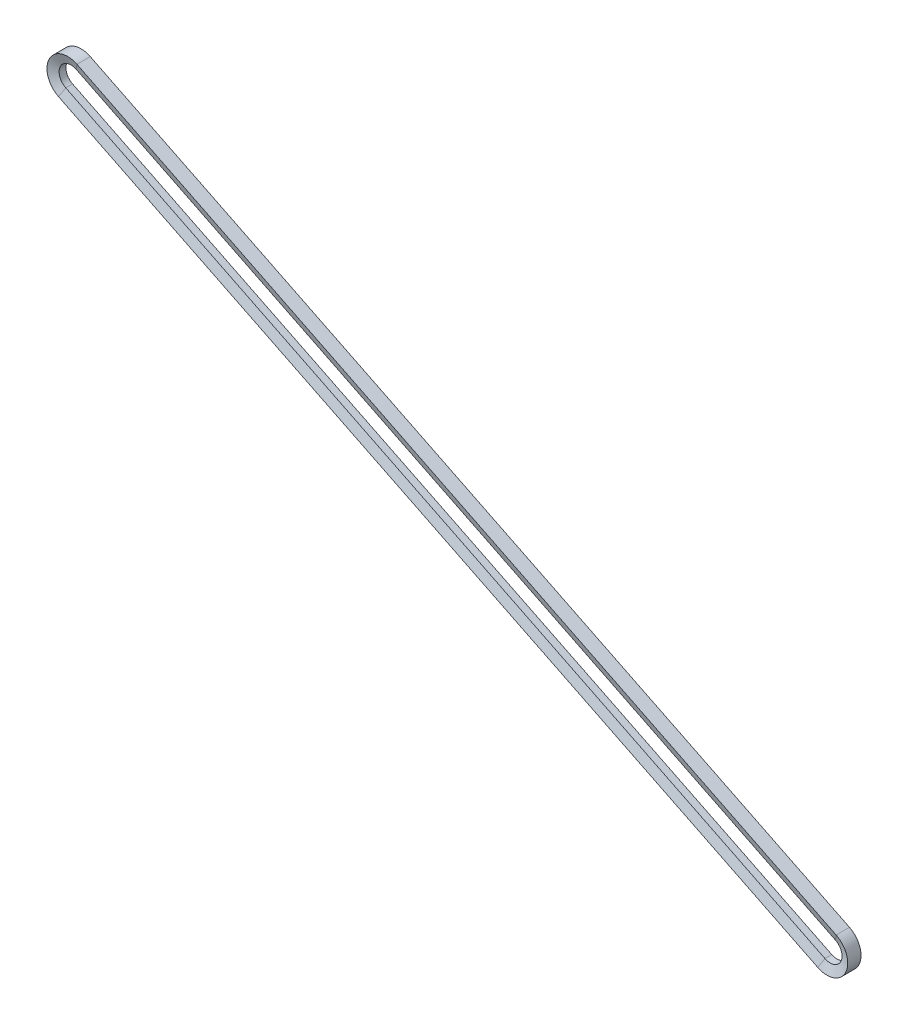
from build123d import *


with BuildPart() as part:
    # 扫描1: sweep along a path in 草图2
    with BuildLine(Plane.XY) as sweep_1_path:
        Line((2.344320341, 4.753331688), (342.117807065, -162.82131882))
        ThreePointArc((342.117807065, -162.82131882), (344.526818412, -169.91897085), (337.429166382, -172.327982197))
        Line((337.429166382, -172.327982197), (-2.344320341, -4.753331688))
        ThreePointArc((-2.344320341, -4.753331688), (-4.753331688, 2.344320341), (2.344320341, 4.753331688))
    # 草图3 → 扫描1 (sweep)
    with BuildSketch(Plane(origin=(0, 0, 0), x_dir=(0, 0, -1), z_dir=(0.8968550354896064, -0.4423245927109829, 0))):
        Polygon((-1.525, 5.3), (1.525, 5.3), (2.980880937, 9.3), (-2.980880937, 9.3), align=None)
    sweep(path=sweep_1_path.line)


solid = part.part
